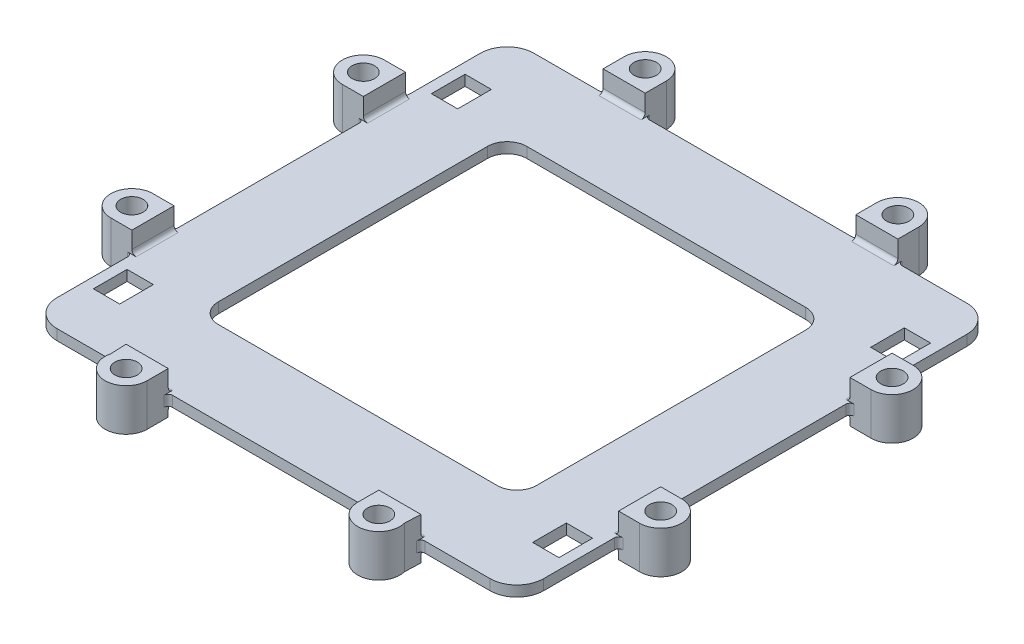
from build123d import *

# Parameters (mm, degrees)
BOSS_EXTRUDE1_DEPTH = 3.175
SKETCH3_W           = 7.9375
SKETCH3_H           = 10.16
CUT_EXTRUDE1_DEPTH  = 3.175
SKETCH4_R           = 3.3909
BOSS_EXTRUDE2_DEPTH = 6.35
FILLET1_R           = 1.27
FILLET2_R           = 1.27
FILLET3_R           = 1.27
FILLET4_R           = 1.27


with BuildPart() as part:
    # Sketch1 → Boss-Extrude1 (new body)
    with BuildSketch(Plane(origin=(0, 0, 0), x_dir=(1, 0, 0), z_dir=(0, 1, 0))):
        with BuildLine():
            Line((0, 0), (0, 127.635))
            ThreePointArc((0, 127.635), (2.373196595, 133.364403405), (8.1026, 135.7376))
            Line((8.1026, 135.7376), (138.6586, 135.7376))
            ThreePointArc((138.6586, 135.7376), (144.388003405, 133.364403405), (146.7612, 127.635))
            Line((146.7612, 127.635), (146.7612, 0))
            ThreePointArc((146.7612, 0), (144.388003405, -5.729403405), (138.6586, -8.1026))
            Line((138.6586, -8.1026), (8.1026, -8.1026))
            ThreePointArc((8.1026, -8.1026), (2.373196595, -5.729403405), (0, 0))
        make_face()
        with BuildLine():
            Line((25.4, 104.418889077), (25.4, 23.216110923))
            ThreePointArc((25.4, 23.216110923), (27.133550294, 19.030950294), (31.318710923, 17.2974))
            Line((31.318710923, 17.2974), (115.442489077, 17.2974))
            ThreePointArc((115.442489077, 17.2974), (119.627649706, 19.030950294), (121.3612, 23.216110923))
            Line((121.3612, 23.216110923), (121.3612, 104.418889077))
            ThreePointArc((121.3612, 104.418889077), (119.627649706, 108.604049706), (115.442489077, 110.3376))
            Line((115.442489077, 110.3376), (31.318710923, 110.3376))
            ThreePointArc((31.318710923, 110.3376), (27.133550294, 108.604049706), (25.4, 104.418889077))
        make_face(mode=Mode.SUBTRACT)
    extrude(amount=BOSS_EXTRUDE1_DEPTH)

    # Sketch3 → Cut-Extrude1 (cut)
    with BuildSketch(Plane(origin=(0, 3.175, 0), x_dir=(1, 0, 0), z_dir=(0, 1, 0))):
        with Locations((7.14375, 114.7826)):
            Rectangle(SKETCH3_W, SKETCH3_H)
        with Locations((139.61745, 114.7826)):
            Rectangle(SKETCH3_W, SKETCH3_H)
        with Locations((139.61745, 12.8524)):
            Rectangle(SKETCH3_W, SKETCH3_H)
        with Locations((7.14375, 12.8524)):
            Rectangle(SKETCH3_W, SKETCH3_H)
    extrude(amount=-CUT_EXTRUDE1_DEPTH, mode=Mode.SUBTRACT)

    # Sketch4 → Boss-Extrude2 (add, symmetric)
    # profile 1 of 8: a face of its own
    with BuildSketch(Plane(origin=(0, 3.175, 0), x_dir=(1, 0, 0), z_dir=(0, 1, 0))):
        with BuildLine():
            Line((28.9306, 135.7376), (41.6306, 135.7376))
            Line((41.6306, 135.7376), (41.6306, 142.0876))
            ThreePointArc((41.6306, 142.0876), (35.2806, 148.4376), (28.9306, 142.0876))
            Line((28.9306, 142.0876), (28.9306, 135.7376))
        make_face()
        with Locations(Location((35.2806, 142.0876, 0), (0, 0, 270))):
            Circle(SKETCH4_R, mode=Mode.SUBTRACT)
    # profile 2 of 8: a face of its own
    with BuildSketch(Plane(origin=(0, 3.175, 0), x_dir=(1, 0, 0), z_dir=(0, 1, 0))):
        with BuildLine():
            Line((41.6306, -8.1026), (41.6306, -14.4526))
            ThreePointArc((41.6306, -14.4526), (34.504736276, -20.755022985), (29.120195124, -12.912498781))
            Line((29.120195124, -12.912498781), (28.9306, -8.1026))
            Line((28.9306, -8.1026), (41.6306, -8.1026))
        make_face()
        with Locations(Location((35.2806, -14.4526, 0), (0, 0, 270))):
            Circle(SKETCH4_R, mode=Mode.SUBTRACT)
    # profile 3 of 8: a face of its own
    with BuildSketch(Plane(origin=(0, 3.175, 0), x_dir=(1, 0, 0), z_dir=(0, 1, 0))):
        with BuildLine():
            Line((117.8306, -8.1026), (117.641004876, -12.912498781))
            ThreePointArc((117.641004876, -12.912498781), (112.256463724, -20.755022985), (105.1306, -14.4526))
            Line((105.1306, -14.4526), (105.1306, -8.1026))
            Line((105.1306, -8.1026), (117.8306, -8.1026))
        make_face()
        with Locations(Location((111.4806, -14.4526, 0), (0, 0, 270))):
            Circle(SKETCH4_R, mode=Mode.SUBTRACT)
    # profile 4 of 8: a face of its own
    with BuildSketch(Plane(origin=(0, 3.175, 0), x_dir=(1, 0, 0), z_dir=(0, 1, 0))):
        with BuildLine():
            Line((117.8306, 135.7376), (117.8306, 142.0876))
            ThreePointArc((117.8306, 142.0876), (111.4806, 148.4376), (105.1306, 142.0876))
            Line((105.1306, 142.0876), (105.1306, 135.7376))
            Line((105.1306, 135.7376), (117.8306, 135.7376))
        make_face()
        with Locations(Location((111.4806, 142.0876, 0), (0, 0, 90))):
            Circle(SKETCH4_R, mode=Mode.SUBTRACT)
    # profile 5 of 8: a face of its own
    with BuildSketch(Plane(origin=(0, 3.175, 0), x_dir=(1, 0, 0), z_dir=(0, 1, 0))):
        with BuildLine():
            Line((146.7612, 92.362412849), (146.7612, 105.062412849))
            Line((146.7612, 105.062412849), (153.1112, 105.062412849))
            ThreePointArc((153.1112, 105.062412849), (159.4612, 98.712412849), (153.1112, 92.362412849))
            Line((153.1112, 92.362412849), (146.7612, 92.362412849))
        make_face()
        with Locations(Location((153.1112, 98.712412849, 0), (0, 0, 270))):
            Circle(SKETCH4_R, mode=Mode.SUBTRACT)
    # profile 6 of 8: a face of its own
    with BuildSketch(Plane(origin=(0, 3.175, 0), x_dir=(1, 0, 0), z_dir=(0, 1, 0))):
        with BuildLine():
            Line((146.7612, 22.572587151), (153.1112, 22.572587151))
            ThreePointArc((153.1112, 22.572587151), (159.4612, 28.922587151), (153.1112, 35.272587151))
            Line((153.1112, 35.272587151), (146.7612, 35.272587151))
            Line((146.7612, 35.272587151), (146.7612, 22.572587151))
        make_face()
        with Locations(Location((153.1112, 28.922587151, 0), (0, 0, 90))):
            Circle(SKETCH4_R, mode=Mode.SUBTRACT)
    # profile 7 of 8: a face of its own
    with BuildSketch(Plane(origin=(0, 3.175, 0), x_dir=(1, 0, 0), z_dir=(0, 1, 0))):
        with BuildLine():
            Line((-6.35, 35.272587151), (0, 35.272587151))
            Line((0, 35.272587151), (0, 22.572587151))
            Line((0, 22.572587151), (-6.35, 22.572587151))
            ThreePointArc((-6.35, 22.572587151), (-12.7, 28.922587151), (-6.35, 35.272587151))
        make_face()
        with Locations(Location((-6.35, 28.922587151, 0), (0, 0, 270))):
            Circle(SKETCH4_R, mode=Mode.SUBTRACT)
    # profile 8 of 8: a face of its own
    with BuildSketch(Plane(origin=(0, 3.175, 0), x_dir=(1, 0, 0), z_dir=(0, 1, 0))):
        with BuildLine():
            Line((0, 92.362412849), (0, 105.062412849))
            Line((0, 105.062412849), (-6.35, 105.062412849))
            ThreePointArc((-6.35, 105.062412849), (-12.7, 98.712412849), (-6.35, 92.362412849))
            Line((-6.35, 92.362412849), (0, 92.362412849))
        make_face()
        with Locations(Location((-6.35, 98.712412849, 0), (0, 0, 270))):
            Circle(SKETCH4_R, mode=Mode.SUBTRACT)
    extrude(amount=BOSS_EXTRUDE2_DEPTH, both=True)

    # Fillet1
    fillet1_edges = [part.edges().sort_by_distance(p)[0] for p in [
        (28.9306, 1.5875, 8.1026),
        (41.6306, 1.5875, 8.1026),
    ]]
    fillet(fillet1_edges, radius=FILLET1_R)

    # Fillet2
    fillet2_edges = [part.edges().sort_by_distance(p)[0] for p in [
        (35.2806, 0, 8.1026),
        (35.2806, 3.175, 8.1026),
    ]]
    fillet(fillet2_edges, radius=FILLET2_R)

    # Fillet3
    fillet3_edges = [part.edges().sort_by_distance(p)[0] for p in [
        (0, 0, -28.922587151),
        (0, 3.175, -28.922587151),
        (111.4806, 3.175, 8.1026),
        (111.4806, 0, 8.1026),
        (146.7612, 0, -28.922587151),
        (146.7612, 3.175, -28.922587151),
        (146.7612, 0, -98.712412849),
        (146.7612, 3.175, -98.712412849),
        (111.4806, 0, -135.7376),
        (111.4806, 3.175, -135.7376),
        (35.2806, 3.175, -135.7376),
        (35.2806, 0, -135.7376),
        (0, 0, -98.712412849),
        (0, 3.175, -98.712412849),
    ]]
    fillet(fillet3_edges, radius=FILLET3_R)

    # Fillet4
    fillet4_edges = [part.edges().sort_by_distance(p)[0] for p in [
        (0, 1.5875, -35.272587151),
        (0, 1.5875, -22.572587151),
        (117.8306, 1.5875, 8.1026),
        (105.1306, 1.5875, 8.1026),
        (146.7612, 1.5875, -35.272587151),
        (146.7612, 1.5875, -22.572587151),
        (146.7612, 1.5875, -105.062412849),
        (146.7612, 1.5875, -92.362412849),
        (105.1306, 1.5875, -135.7376),
        (117.8306, 1.5875, -135.7376),
        (28.9306, 1.5875, -135.7376),
        (41.6306, 1.5875, -135.7376),
        (0, 1.5875, -92.362412849),
        (0, 1.5875, -105.062412849),
    ]]
    fillet(fillet4_edges, radius=FILLET4_R)


solid = part.part
